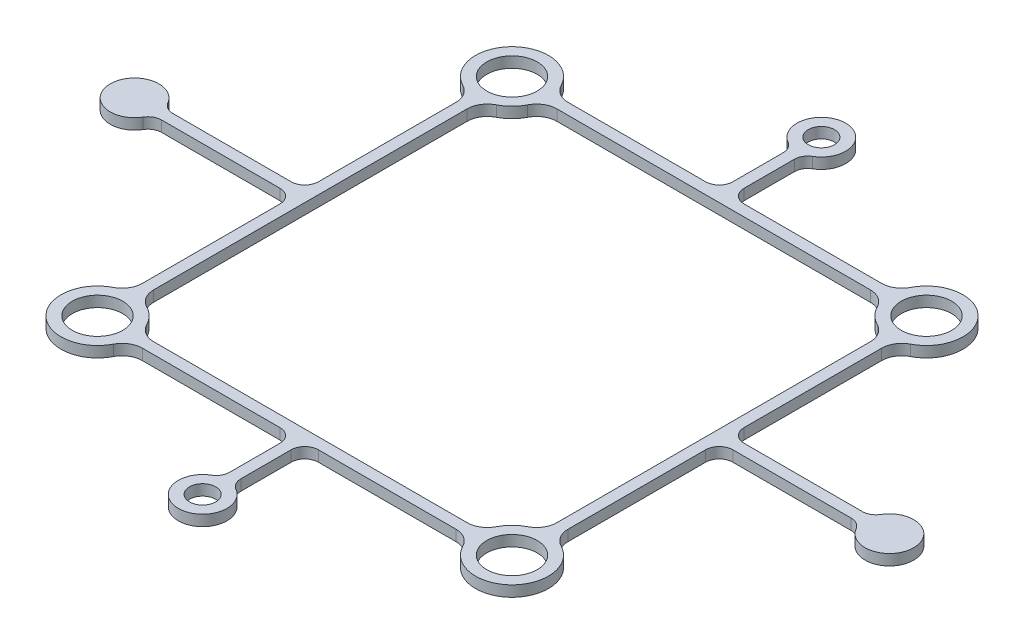
from build123d import *

# Parameters (mm, degrees)
SKETCH1_R           = 3.71
SKETCH1_R_2         = 1.925
BOSS_EXTRUDE1_DEPTH = 1.5875
FILLET1_R           = 3
FILLET2_R           = 2
FILLET3_R           = 2


with BuildPart() as part:
    # Sketch1 → Boss-Extrude1 (new body)
    with BuildSketch(Plane(origin=(0, 0, 0), x_dir=(1, 0, 0), z_dir=(0, 1, 0))):
        with BuildLine():
            Line((-25.148871697, 31.27), (-0.825, 31.27))
            Line((-0.825, 31.27), (-0.825, 41.966494574))
            ThreePointArc((-0.825, 41.966494574), (0, 49.02), (0.825, 41.966494574))
            Line((0.825, 41.966494574), (0.825, 31.27))
            Line((0.825, 31.27), (25.148871697, 31.27))
            ThreePointArc((25.148871697, 31.27), (34.235092347, 34.235092347), (31.27, 25.148871697))
            Line((31.27, 25.148871697), (31.27, 0.825))
            Line((31.27, 0.825), (51.966494574, 0.825))
            ThreePointArc((51.966494574, 0.825), (59.02, 0), (51.966494574, -0.825))
            Line((51.966494574, -0.825), (31.27, -0.825))
            Line((31.27, -0.825), (31.27, -25.148871697))
            ThreePointArc((31.27, -25.148871697), (34.235092347, -34.235092347), (25.148871697, -31.27))
            Line((25.148871697, -31.27), (0.825, -31.27))
            Line((0.825, -31.27), (0.825, -41.966494574))
            ThreePointArc((0.825, -41.966494574), (0, -49.02), (-0.825, -41.966494574))
            Line((-0.825, -41.966494574), (-0.825, -31.27))
            Line((-0.825, -31.27), (-25.148871697, -31.27))
            ThreePointArc((-25.148871697, -31.27), (-34.235092347, -34.235092347), (-31.27, -25.148871697))
            Line((-31.27, -25.148871697), (-31.27, -0.825))
            Line((-31.27, -0.825), (-51.966494574, -0.825))
            ThreePointArc((-51.966494574, -0.825), (-59.02, 0), (-51.966494574, 0.825))
            Line((-51.966494574, 0.825), (-31.27, 0.825))
            Line((-31.27, 0.825), (-31.27, 25.148871697))
            ThreePointArc((-31.27, 25.148871697), (-34.235092347, 34.235092347), (-25.148871697, 31.27))
        make_face()
        with Locations(Location((-30.445, 30.445, 0), (0, 0, 270))):
            Circle(SKETCH1_R, mode=Mode.SUBTRACT)
        with Locations(Location((30.445, 30.445, 0), (0, 0, 90))):
            Circle(SKETCH1_R, mode=Mode.SUBTRACT)
        with Locations(Location((30.445, -30.445, 0), (0, 0, 270))):
            Circle(SKETCH1_R, mode=Mode.SUBTRACT)
        with Locations(Location((-30.445, -30.445, 0), (0, 0, 90))):
            Circle(SKETCH1_R, mode=Mode.SUBTRACT)
        with Locations(Location((0, 45.445, 0), (0, 0, 270))):
            Circle(SKETCH1_R_2, mode=Mode.SUBTRACT)
        with Locations(Location((0, -45.445, 0), (0, 0, 90))):
            Circle(SKETCH1_R_2, mode=Mode.SUBTRACT)
        with BuildLine():
            Line((-25.148871697, 29.62), (25.148871697, 29.62))
            ThreePointArc((25.148871697, 29.62), (26.654907653, 26.654907653), (29.62, 25.148871697))
            Line((29.62, 25.148871697), (29.62, -25.148871697))
            ThreePointArc((29.62, -25.148871697), (26.654907653, -26.654907653), (25.148871697, -29.62))
            Line((25.148871697, -29.62), (-25.148871697, -29.62))
            ThreePointArc((-25.148871697, -29.62), (-26.654907653, -26.654907653), (-29.62, -25.148871697))
            Line((-29.62, -25.148871697), (-29.62, 25.148871697))
            ThreePointArc((-29.62, 25.148871697), (-26.654907653, 26.654907653), (-25.148871697, 29.62))
        make_face(mode=Mode.SUBTRACT)
    extrude(amount=BOSS_EXTRUDE1_DEPTH)

    # Fillet1
    fillet1_edges = [part.edges().sort_by_distance(p)[0] for p in [
        (25.148871697, 0.79375, -31.27),
        (31.27, 0.79375, -25.148871697),
        (31.27, 0.79375, 25.148871697),
        (25.148871697, 0.79375, 31.27),
        (-25.148871697, 0.79375, 31.27),
        (-31.27, 0.79375, 25.148871697),
        (-31.27, 0.79375, -25.148871697),
        (-25.148871697, 0.79375, -31.27),
        (-25.148871697, 0.79375, -29.62),
        (-29.62, 0.79375, -25.148871697),
        (-29.62, 0.79375, 25.148871697),
        (-25.148871697, 0.79375, 29.62),
        (25.148871697, 0.79375, 29.62),
        (29.62, 0.79375, 25.148871697),
        (29.62, 0.79375, -25.148871697),
        (25.148871697, 0.79375, -29.62),
    ]]
    fillet(fillet1_edges, radius=FILLET1_R)

    # Fillet2
    fillet2_edges = [part.edges().sort_by_distance(p)[0] for p in [
        (0.825, 0.79375, -31.27),
        (31.27, 0.79375, -0.825),
        (31.27, 0.79375, 0.825),
        (0.825, 0.79375, 31.27),
        (-0.825, 0.79375, 31.27),
        (-31.27, 0.79375, 0.825),
        (-31.27, 0.79375, -0.825),
        (-0.825, 0.79375, -31.27),
    ]]
    fillet(fillet2_edges, radius=FILLET2_R)

    # Fillet3
    fillet3_edges = [part.edges().sort_by_distance(p)[0] for p in [
        (0.825, 0.79375, -41.966494574),
        (51.966494574, 0.79375, -0.825),
        (51.966494574, 0.79375, 0.825),
        (0.825, 0.79375, 41.966494574),
        (-0.825, 0.79375, 41.966494574),
        (-51.966494574, 0.79375, 0.825),
        (-51.966494574, 0.79375, -0.825),
        (-0.825, 0.79375, -41.966494574),
    ]]
    fillet(fillet3_edges, radius=FILLET3_R)


solid = part.part
